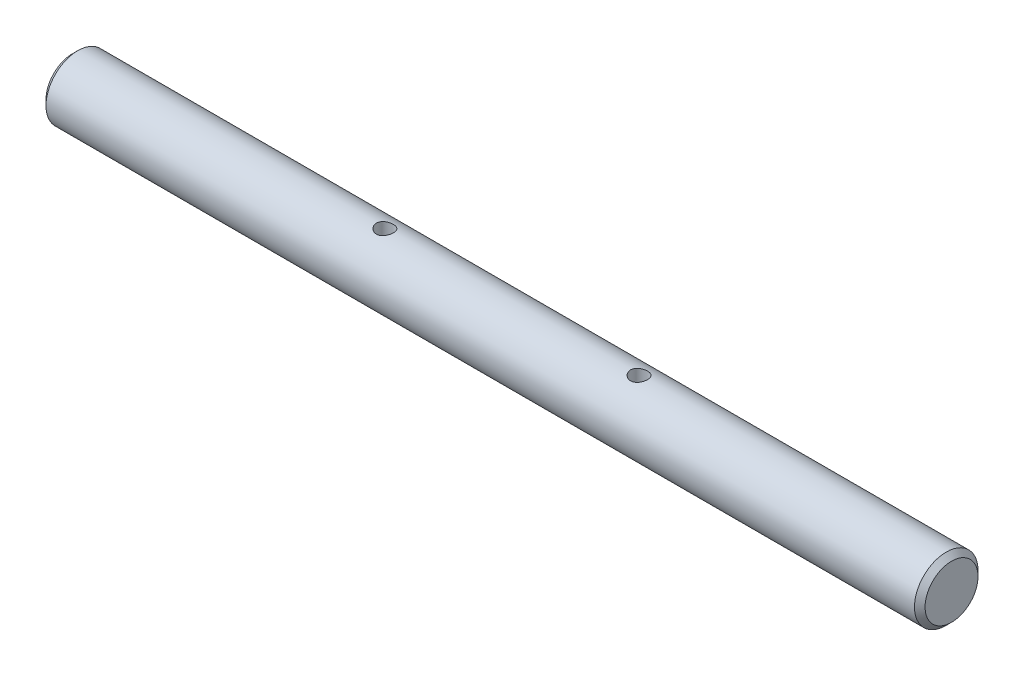
from build123d import *

# Parameters (mm, degrees)
SKETCH_1_W                  = 830
SKETCH_1_H                  = 30
CHAMFER_1_SIZE              = 5
HOLE_WIZARD_16_0_16_1_D     = 16
HOLE_WIZARD_16_0_16_1_DEPTH = 15
HOLE_WIZARD_16_0_16_1_TIP   = 4.806884952


with BuildPart() as part:
    # 草图1 → 旋转1 (revolve)
    with BuildSketch(Plane.XY):
        with Locations((-415, 15)):
            Rectangle(SKETCH_1_W, SKETCH_1_H)
    revolve(axis=Axis((0, 0, 0), (-1, 0, 0)))

    # 倒角1
    chamfer_1_edges = [part.edges().sort_by_distance(p)[0] for p in [
        (0, -30, 0),
        (-830, -30, 0),
    ]]
    chamfer(chamfer_1_edges, length=CHAMFER_1_SIZE)

    # Ø16.0 (16) 直径孔1
    with Locations(Plane(origin=(0, 30, 0), x_dir=(1, 0, 0), z_dir=(0, 1, 0))):
        with Locations((-535, 0), (-295, 0)):
            Hole(HOLE_WIZARD_16_0_16_1_D / 2, depth=HOLE_WIZARD_16_0_16_1_DEPTH)
            with Locations((0, 0, -(HOLE_WIZARD_16_0_16_1_DEPTH + HOLE_WIZARD_16_0_16_1_TIP / 2))):  # 118° drill point
                Cone(0, HOLE_WIZARD_16_0_16_1_D / 2, HOLE_WIZARD_16_0_16_1_TIP, mode=Mode.SUBTRACT)


solid = part.part
